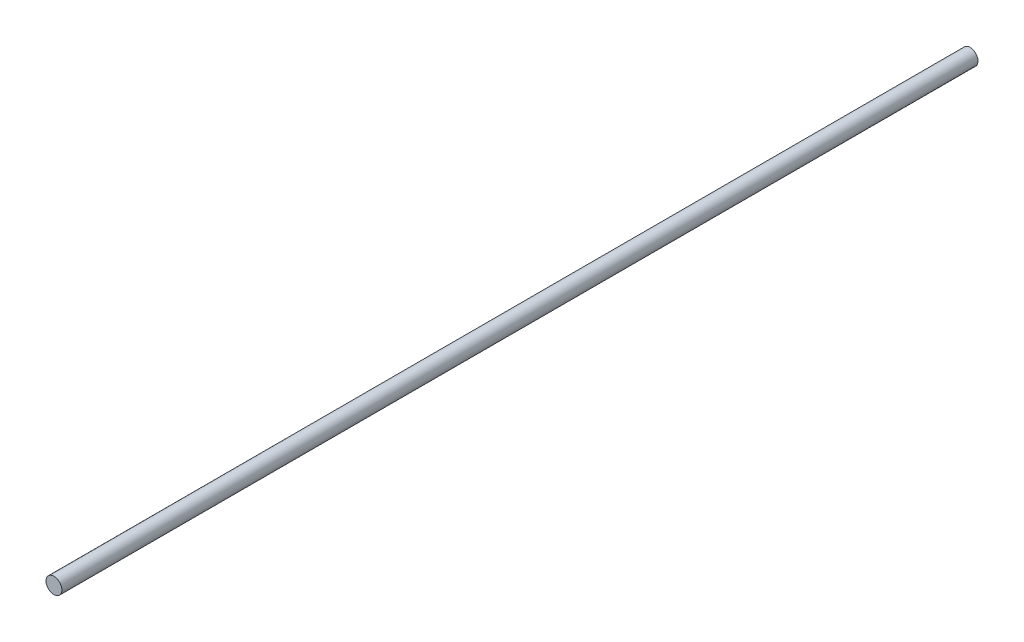
from build123d import *

# Parameters (mm, degrees)
SKETCH_1_R      = 6
EXTRUDE_1_DEPTH = 693


with BuildPart() as part:
    # Эскиз1 → Бобышка-Вытянуть1 (new body)
    with BuildSketch(Plane.XY):
        Circle(SKETCH_1_R)
    extrude(amount=EXTRUDE_1_DEPTH)


solid = part.part
